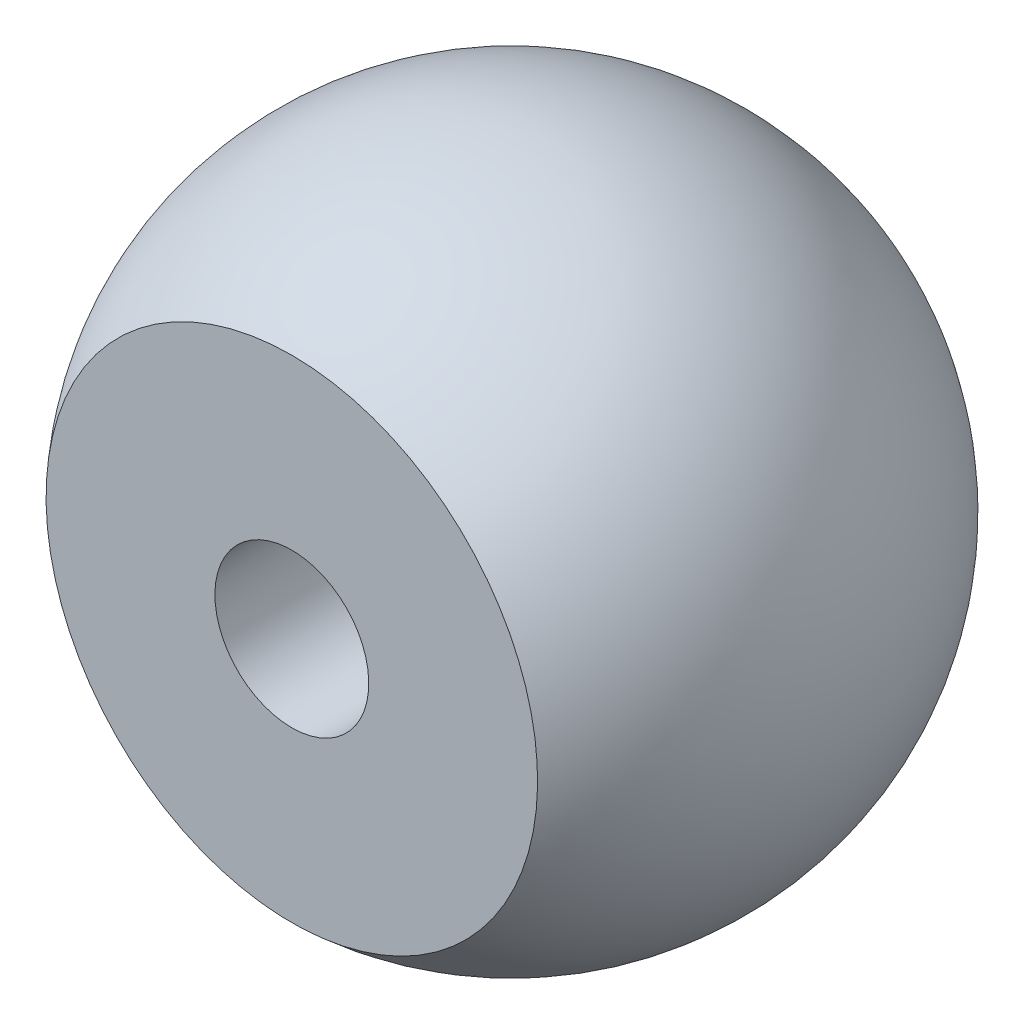
from build123d import *

# Parameters (mm, degrees)
CUT_EXTRUDE_1_DEPTH      = 16.588457268
CUT_EXTRUDE_1_DEPTH_BACK = 16.588457268
SKETCH_2_W               = 8.784286405
SKETCH_2_H               = 20.773221584
HOLE_WIZARD_M5_1_D       = 4.2
HOLE_WIZARD_M5_1_DEPTH   = 7
HOLE_WIZARD_M5_1_TIP     = 1.2618073


with BuildPart() as part:
    # 草图1 → 旋转1 (revolve)
    with BuildSketch(Plane(origin=(0, 0, 0), x_dir=(0, 0, -1), z_dir=(1, 0, 0))):
        with BuildLine():
            Line((0, 9), (0, -9))
            ThreePointArc((0, -9), (-9, 0), (0, 9))
        make_face()
    revolve(axis=Axis((0, 9, 0), (0, -1, 0)))

    # 草图2 → 切除-拉伸1 (cut, two sides: drawn at the far end of the back side and taken through both)
    with BuildSketch(Plane(origin=(0, 0, 0), x_dir=(0, 0, -1), z_dir=(1, 0, 0)).offset(-CUT_EXTRUDE_1_DEPTH_BACK)):
        with Locations((-10.392143203, 0)):
            Rectangle(SKETCH_2_W, SKETCH_2_H)
    extrude(amount=CUT_EXTRUDE_1_DEPTH + CUT_EXTRUDE_1_DEPTH_BACK, mode=Mode.SUBTRACT)

    # M5 螺纹孔1
    with Locations(Plane(origin=(0, 0, 6), x_dir=(0, 1, 0), z_dir=(0, 0, 1))):
        with Locations((0, 0)):
            Hole(HOLE_WIZARD_M5_1_D / 2, depth=HOLE_WIZARD_M5_1_DEPTH)
            with Locations((0, 0, -(HOLE_WIZARD_M5_1_DEPTH + HOLE_WIZARD_M5_1_TIP / 2))):  # 118° drill point
                Cone(0, HOLE_WIZARD_M5_1_D / 2, HOLE_WIZARD_M5_1_TIP, mode=Mode.SUBTRACT)


solid = part.part
